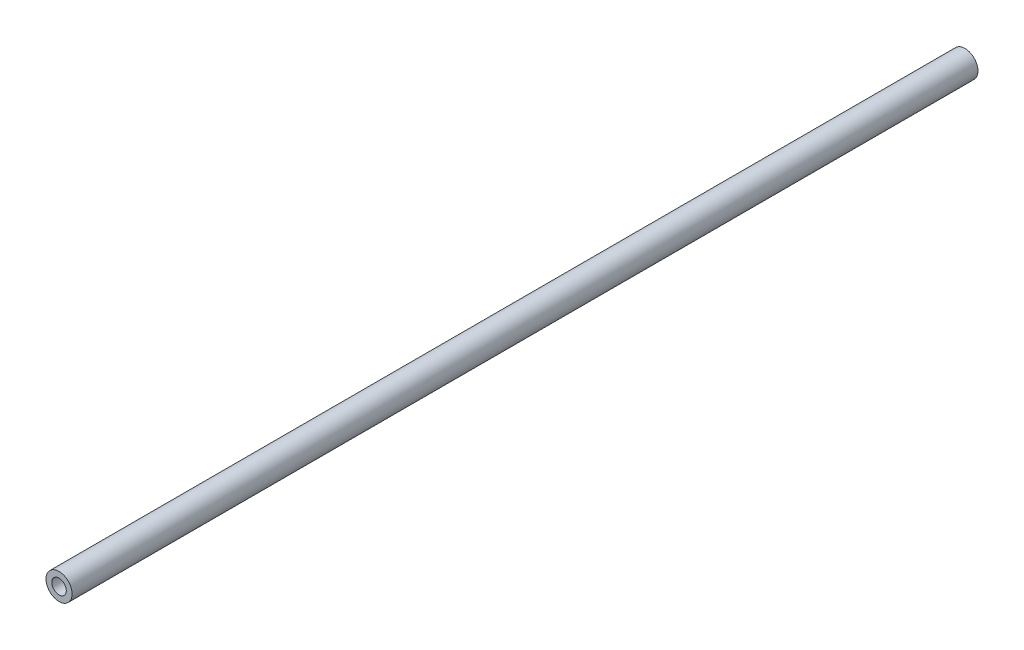
from build123d import *

# Parameters (mm, degrees)
SKETCH32_R          = 8.55
SKETCH32_R_2        = 4.765
BOSS_EXTRUDE1_DEPTH = 593.65


with BuildPart() as part:
    # Sketch32 → Boss-Extrude1 (new body)
    with BuildSketch(Plane.XY):
        Circle(SKETCH32_R)
        Circle(SKETCH32_R_2, mode=Mode.SUBTRACT)
    extrude(amount=BOSS_EXTRUDE1_DEPTH)


solid = part.part
